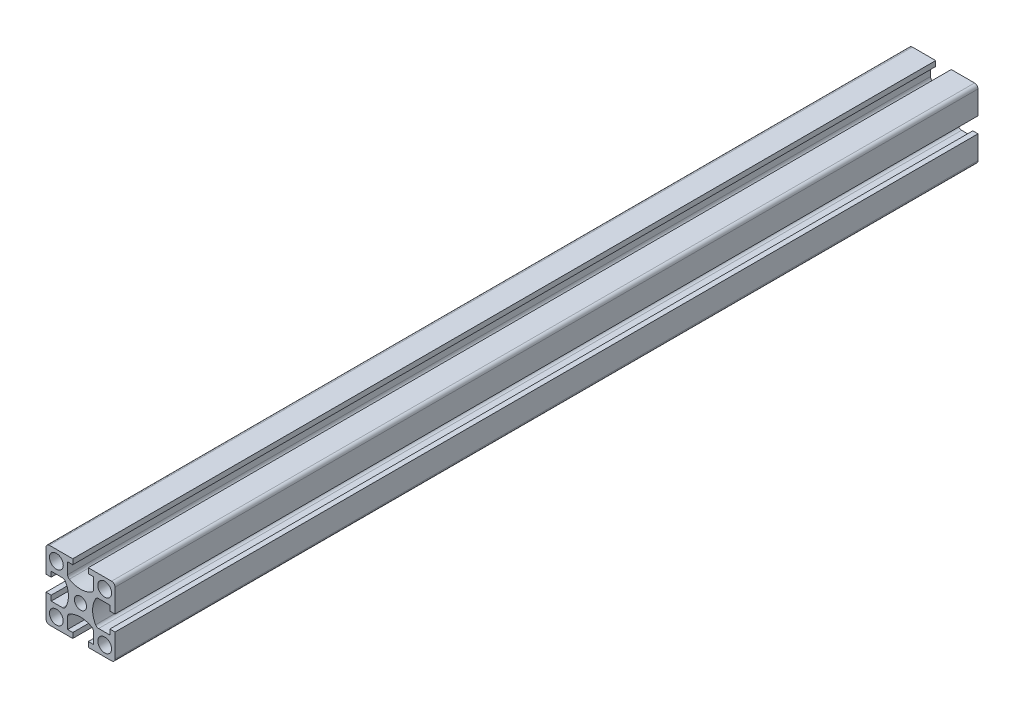
from build123d import *

# Parameters (mm, degrees)
SKETCH1_R           = 2
SKETCH1_R_2         = 1.75
BOSS_EXTRUDE1_DEPTH = 250


with BuildPart() as part:
    # Sketch1 → Boss-Extrude1 (new body)
    with BuildSketch(Plane.XY):
        with BuildLine():
            Line((-10, 9), (-10, 2.25))
            Line((-10, 2.25), (-8.5, 2.25))
            Line((-8.5, 2.25), (-8.5, 3.75))
            Line((-8.5, 3.75), (-5.236860279, 3.75))
            ThreePointArc((-5.236860279, 3.75), (-4.736860279, 3.616025404), (-4.370834875, 3.25))
            ThreePointArc((-4.370834875, 3.25), (-3.5, 0), (-4.370834875, -3.25))
            ThreePointArc((-4.370834875, -3.25), (-4.736860279, -3.616025404), (-5.236860279, -3.75))
            Line((-5.236860279, -3.75), (-8.5, -3.75))
            Line((-8.5, -3.75), (-8.5, -2.25))
            Line((-8.5, -2.25), (-10, -2.25))
            Line((-10, -2.25), (-10, -9))
            ThreePointArc((-10, -9), (-9.707106781, -9.707106781), (-9, -10))
            Line((-9, -10), (-2.25, -10))
            Line((-2.25, -10), (-2.25, -8.5))
            Line((-2.25, -8.5), (-3.75, -8.5))
            Line((-3.75, -8.5), (-3.75, -5.236860279))
            ThreePointArc((-3.75, -5.236860279), (-3.616025404, -4.736860279), (-3.25, -4.370834875))
            ThreePointArc((-3.25, -4.370834875), (0, -3.5), (3.25, -4.370834875))
            ThreePointArc((3.25, -4.370834875), (3.616025404, -4.736860279), (3.75, -5.236860279))
            Line((3.75, -5.236860279), (3.75, -8.5))
            Line((3.75, -8.5), (2.25, -8.5))
            Line((2.25, -8.5), (2.25, -10))
            Line((2.25, -10), (9, -10))
            ThreePointArc((9, -10), (9.707106781, -9.707106781), (10, -9))
            Line((10, -9), (10, -2.25))
            Line((10, -2.25), (8.5, -2.25))
            Line((8.5, -2.25), (8.5, -3.75))
            Line((8.5, -3.75), (5.236860279, -3.75))
            ThreePointArc((5.236860279, -3.75), (4.736860279, -3.616025404), (4.370834875, -3.25))
            ThreePointArc((4.370834875, -3.25), (3.5, 0), (4.370834875, 3.25))
            ThreePointArc((4.370834875, 3.25), (4.736860279, 3.616025404), (5.236860279, 3.75))
            Line((5.236860279, 3.75), (8.5, 3.75))
            Line((8.5, 3.75), (8.5, 2.25))
            Line((8.5, 2.25), (10, 2.25))
            Line((10, 2.25), (10, 9))
            ThreePointArc((10, 9), (9.707106781, 9.707106781), (9, 10))
            Line((9, 10), (2.25, 10))
            Line((2.25, 10), (2.25, 8.5))
            Line((2.25, 8.5), (3.75, 8.5))
            Line((3.75, 8.5), (3.75, 5.236860279))
            ThreePointArc((3.75, 5.236860279), (3.616025404, 4.736860279), (3.25, 4.370834875))
            ThreePointArc((3.25, 4.370834875), (0, 3.5), (-3.25, 4.370834875))
            ThreePointArc((-3.25, 4.370834875), (-3.616025404, 4.736860279), (-3.75, 5.236860279))
            Line((-3.75, 5.236860279), (-3.75, 8.5))
            Line((-3.75, 8.5), (-2.25, 8.5))
            Line((-2.25, 8.5), (-2.25, 10))
            Line((-2.25, 10), (-9, 10))
            ThreePointArc((-9, 10), (-9.707106781, 9.707106781), (-10, 9))
        make_face()
        with Locations((-7, -7)):
            Circle(SKETCH1_R, mode=Mode.SUBTRACT)
        with Locations((7, -7)):
            Circle(SKETCH1_R, mode=Mode.SUBTRACT)
        with Locations((7, 7)):
            Circle(SKETCH1_R, mode=Mode.SUBTRACT)
        Circle(SKETCH1_R_2, mode=Mode.SUBTRACT)
        with Locations((-7, 7)):
            Circle(SKETCH1_R, mode=Mode.SUBTRACT)
    extrude(amount=BOSS_EXTRUDE1_DEPTH)


solid = part.part
